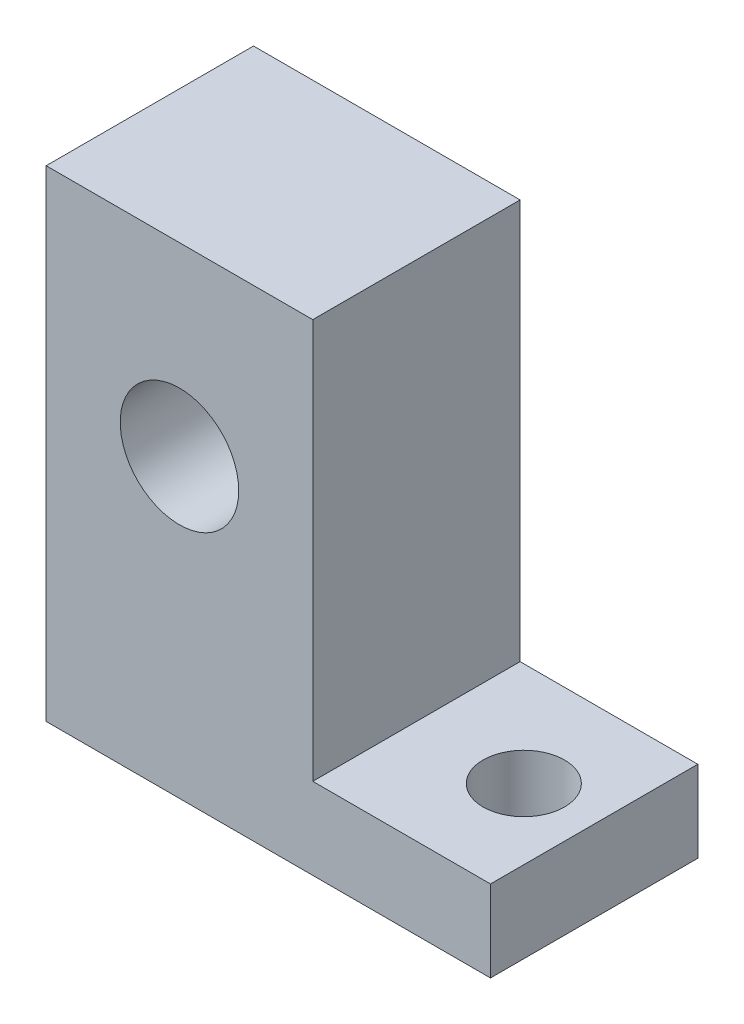
from build123d import *

# Parameters (mm, degrees)
SKETCH_1_R          = 4
EXTRUDE_1_DEPTH     = 14
SKETCH_2_R          = 2.75
CUT_EXTRUDE_1_DEPTH = 14
SKETCH_3_W          = 12
SKETCH_3_H          = 14
CUT_EXTRUDE_2_DEPTH = 10


with BuildPart() as part:
    # 草图1 → 凸台-拉伸1 (new body)
    with BuildSketch(Plane.XY):
        Polygon((-21, -10.75), (-9, -10.75), (-9, 16.25), (9, 16.25), (9, -10.75), (21, -10.75), (21, -16.25), (-21, -16.25), align=None)
        with Locations((0, 3.75)):
            Circle(SKETCH_1_R, mode=Mode.SUBTRACT)
    extrude(amount=EXTRUDE_1_DEPTH)

    # 草图2 → 切除-拉伸1 (cut)
    with BuildSketch(Plane(origin=(0, -10.75, 0), x_dir=(1, 0, 0), z_dir=(0, 1, 0))):
        with Locations(Location((-16.25, -7, 0), (0, 0, 270))):
            Circle(SKETCH_2_R)
        with Locations(Location((16.25, -7, 0), (0, 0, 270))):
            Circle(SKETCH_2_R)
    extrude(amount=-CUT_EXTRUDE_1_DEPTH, mode=Mode.SUBTRACT)

    # 草图3 → 切除-拉伸2 (cut)
    with BuildSketch(Plane(origin=(0, -10.75, 0), x_dir=(1, 0, 0), z_dir=(0, 1, 0))):
        with Locations((-15, -7)):
            Rectangle(SKETCH_3_W, SKETCH_3_H)
    extrude(amount=-CUT_EXTRUDE_2_DEPTH, mode=Mode.SUBTRACT)


solid = part.part
